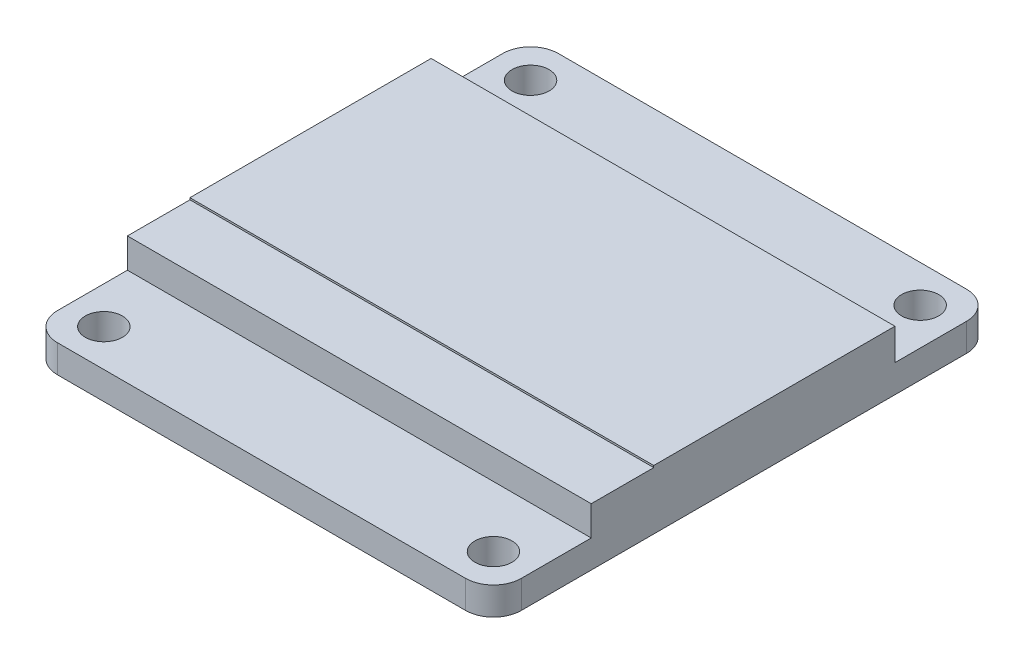
from build123d import *

# Parameters (mm, degrees)
EXTRUDE_1_DEPTH     = 1.5
SKETCH_3_R          = 1
CUT_EXTRUDE_1_DEPTH = 152.226038202
SKETCH_4_W          = 25
SKETCH_4_H          = 16.37
EXTRUDE_2_DEPTH     = 1.6
SKETCH_5_W          = 25
SKETCH_5_H          = 13
EXTRUDE_3_DEPTH     = 0.1


with BuildPart() as part:
    # 草图2 → 凸台-拉伸1 (new body)
    with BuildSketch(Plane(origin=(0, 0, 0), x_dir=(1, 0, 0), z_dir=(0, 1, 0))):
        with BuildLine():
            Line((-118.257462687, 92.332089552), (-96.257462687, 92.332089552))
            ThreePointArc((-96.257462687, 92.332089552), (-95.196802515, 91.892749724), (-94.757462687, 90.832089552))
            Line((-94.757462687, 90.832089552), (-94.757462687, 66.832089552))
            ThreePointArc((-94.757462687, 66.832089552), (-95.196802515, 65.77142938), (-96.257462687, 65.332089552))
            Line((-96.257462687, 65.332089552), (-118.257462687, 65.332089552))
            ThreePointArc((-118.257462687, 65.332089552), (-119.318122858, 65.77142938), (-119.757462687, 66.832089552))
            Line((-119.757462687, 66.832089552), (-119.757462687, 90.832089552))
            ThreePointArc((-119.757462687, 90.832089552), (-119.318122858, 91.892749724), (-118.257462687, 92.332089552))
        make_face()
    extrude(amount=EXTRUDE_1_DEPTH)

    # 草图3 → 切除-拉伸1 (cut, through all)
    with BuildSketch(Plane(origin=(0, 1.5, 0), x_dir=(1, 0, 0), z_dir=(0, 1, 0))):
        with Locations(Location((-117.757462687, 90.332089552, 0), (0, 0, 270))):
            Circle(SKETCH_3_R)
        with Locations(Location((-96.757462687, 90.332089552, 0), (0, 0, 270))):
            Circle(SKETCH_3_R)
        with Locations(Location((-96.757462687, 67.332089552, 0), (0, 0, 270))):
            Circle(SKETCH_3_R)
        with Locations(Location((-117.757462687, 67.332089552, 0), (0, 0, 270))):
            Circle(SKETCH_3_R)
    extrude(amount=-CUT_EXTRUDE_1_DEPTH, mode=Mode.SUBTRACT)

    # 草图4 → 凸台-拉伸2 (add)
    with BuildSketch(Plane(origin=(0, 1.5, 0), x_dir=(1, 0, 0), z_dir=(0, 1, 0))):
        with Locations((-107.257462687, 78.787089552)):
            Rectangle(SKETCH_4_W, SKETCH_4_H)
    extrude(amount=EXTRUDE_2_DEPTH)

    # 草图5 → 凸台-拉伸3 (add)
    with BuildSketch(Plane(origin=(0, 3.1, 0), x_dir=(1, 0, 0), z_dir=(0, 1, 0))):
        with Locations((-107.257462687, 80.472089552)):
            Rectangle(SKETCH_5_W, SKETCH_5_H)
    extrude(amount=EXTRUDE_3_DEPTH)


solid = part.part
